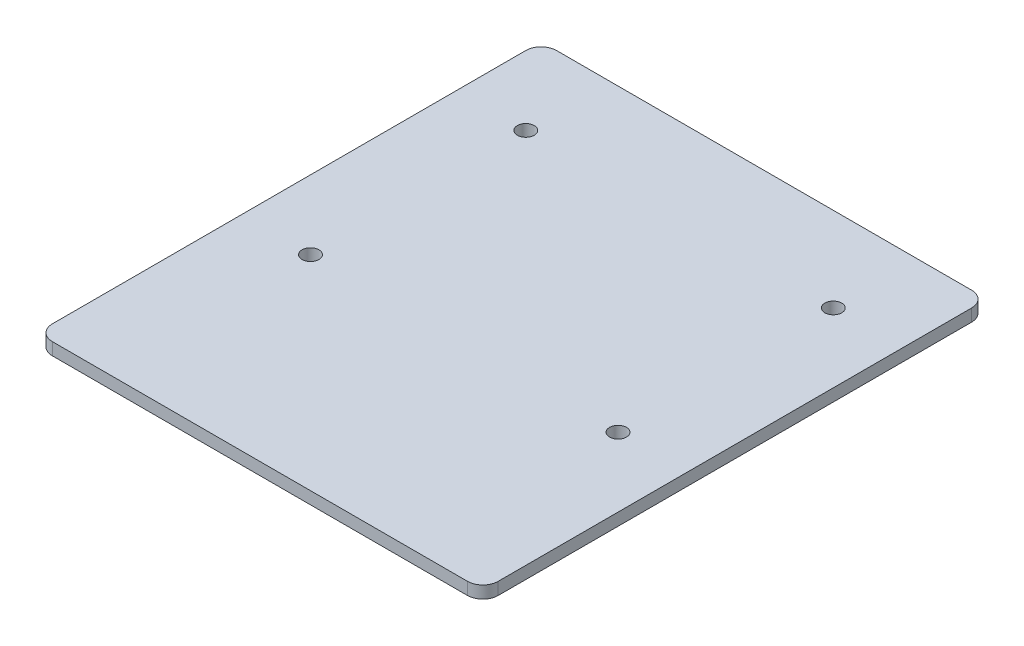
from build123d import *

# Parameters (mm, degrees)
SKETCH_1_W          = 145
SKETCH_1_H          = 163.96571483
F_145X120X4MM_DEPTH = 4
SKETCH_2_R          = 2.75
M3_90X70MM_DEPTH    = 162.686711765
FILLET_R5_R         = 5


with BuildPart() as part:
    # 草图1 → 承托板_145x120x4mm (new body)
    with BuildSketch(Plane(origin=(0, 0, 0), x_dir=(1, 0, 0), z_dir=(0, 1, 0))):
        with Locations((0, -62.482857415)):
            Rectangle(SKETCH_1_W, SKETCH_1_H)
    extrude(amount=F_145X120X4MM_DEPTH)

    # 草图2 → 四个M3连接孔_90x70mm (cut, through all)
    with BuildSketch(Plane(origin=(0, 4, 0), x_dir=(1, 0, 0), z_dir=(0, 1, 0))):
        with Locations(Location((-50, -8, 0), (0, 0, 270))):
            Circle(SKETCH_2_R)
        with Locations(Location((-50, -78, 0), (0, 0, 270))):
            Circle(SKETCH_2_R)
        with Locations(Location((50, -8, 0), (0, 0, 270))):
            Circle(SKETCH_2_R)
        with Locations(Location((50, -78, 0), (0, 0, 270))):
            Circle(SKETCH_2_R)
    extrude(amount=-M3_90X70MM_DEPTH, mode=Mode.SUBTRACT)

    # 四角圆角_R5
    fillet_r5_edges = [part.edges().sort_by_distance(p)[0] for p in [
        (-72.5, 2, -19.5),
        (72.5, 2, -19.5),
        (72.5, 2, 144.46571483),
        (-72.5, 2, 144.46571483),
    ]]
    fillet(fillet_r5_edges, radius=FILLET_R5_R)


solid = part.part
